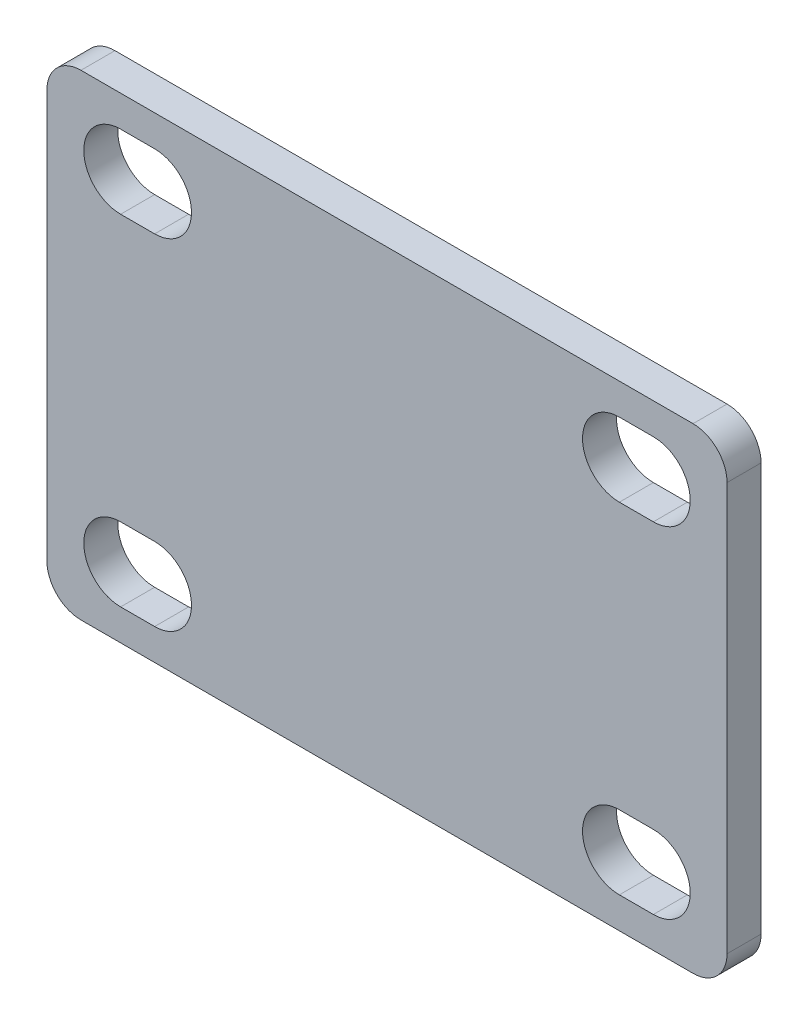
from build123d import *

# Parameters (mm, degrees)
SKETCH_1_W          = 60
SKETCH_1_H          = 42
EXTRUDE_1_DEPTH     = 3
CUT_EXTRUDE_1_DEPTH = 3
FILLET_1_R          = 3


with BuildPart() as part:
    # 草图1 → 凸台-拉伸1 (new body)
    with BuildSketch(Plane.XY):
        Rectangle(SKETCH_1_W, SKETCH_1_H)
    extrude(amount=EXTRUDE_1_DEPTH)

    # 草图2 → 切除-拉伸1 (cut)
    with BuildSketch(Plane.XY.offset(3)):
        with BuildLine():
            Line((-23.5, 18.25), (-20.5, 18.25))
            ThreePointArc((-20.5, 18.25), (-17.25, 15), (-20.5, 11.75))
            Line((-20.5, 11.75), (-23.5, 11.75))
            ThreePointArc((-23.5, 11.75), (-26.75, 15), (-23.5, 18.25))
        make_face()
        with BuildLine():
            Line((20.5, 18.25), (23.5, 18.25))
            ThreePointArc((23.5, 18.25), (26.75, 15), (23.5, 11.75))
            Line((23.5, 11.75), (20.5, 11.75))
            ThreePointArc((20.5, 11.75), (17.25, 15), (20.5, 18.25))
        make_face()
        with BuildLine():
            Line((20.5, -18.25), (23.5, -18.25))
            ThreePointArc((23.5, -18.25), (26.75, -15), (23.5, -11.75))
            Line((23.5, -11.75), (20.5, -11.75))
            ThreePointArc((20.5, -11.75), (17.25, -15), (20.5, -18.25))
        make_face()
        with BuildLine():
            Line((-23.5, -18.25), (-20.5, -18.25))
            ThreePointArc((-20.5, -18.25), (-17.25, -15), (-20.5, -11.75))
            Line((-20.5, -11.75), (-23.5, -11.75))
            ThreePointArc((-23.5, -11.75), (-26.75, -15), (-23.5, -18.25))
        make_face()
    extrude(amount=-CUT_EXTRUDE_1_DEPTH, mode=Mode.SUBTRACT)

    # 圆角1
    fillet_1_edges = [part.edges().sort_by_distance(p)[0] for p in [
        (-30, 21, 1.5),
        (30, 21, 1.5),
        (30, -21, 1.5),
        (-30, -21, 1.5),
    ]]
    fillet(fillet_1_edges, radius=FILLET_1_R)


solid = part.part
